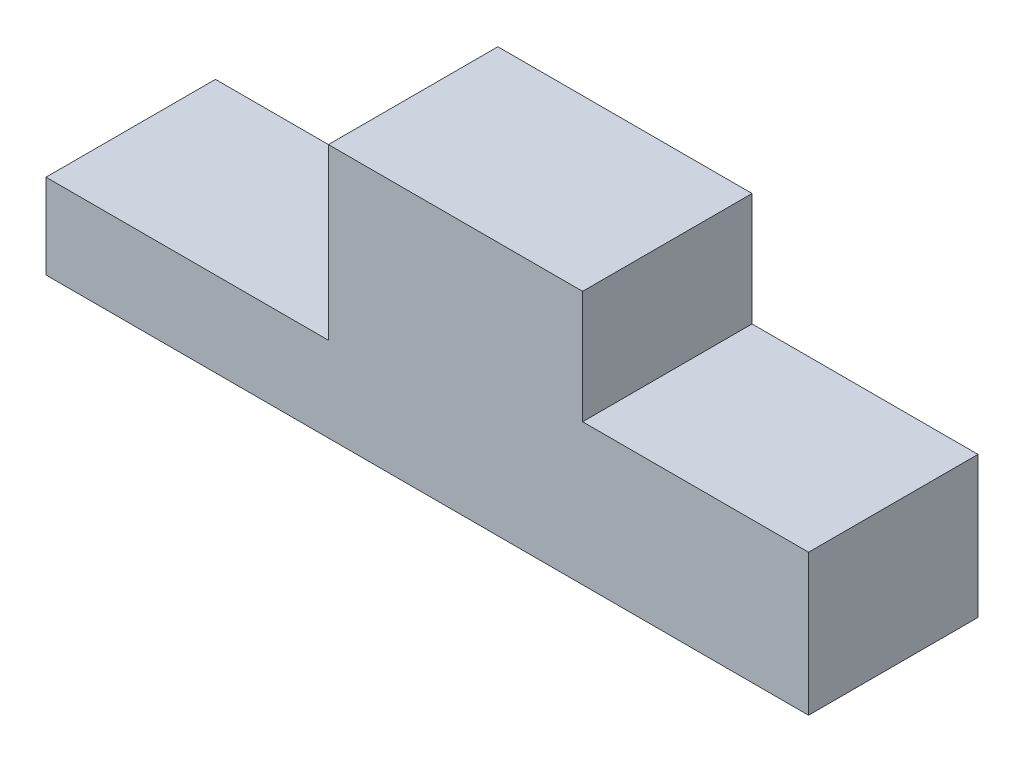
from build123d import *

# Parameters (mm, degrees)
SCHIZZO1_W                   = 50
SCHIZZO1_H                   = 30
ESTRUSIONE_ESTRUSIONE1_DEPTH = 15
SCHIZZO3_W                   = 45
SCHIZZO3_H                   = 15
ESTRUSIONE_ESTRUSIONE2_DEPTH = 15
SCHIZZO4_W                   = 45
SCHIZZO4_H                   = 30
ESTRUSIONE_ESTRUSIONE3_DEPTH = 15
SCHIZZO5_W                   = 40
SCHIZZO5_H                   = 30
ESTRUSIONE_ESTRUSIONE4_DEPTH = 25


with BuildPart() as part:
    # Schizzo1 → Estrusione-Estrusione1 (new body)
    with BuildSketch(Plane(origin=(0, 0, 0), x_dir=(1, 0, 0), z_dir=(0, 1, 0))):
        with Locations((-25, 0)):
            Rectangle(SCHIZZO1_W, SCHIZZO1_H)
    extrude(amount=ESTRUSIONE_ESTRUSIONE1_DEPTH)

    # Schizzo3 → Estrusione-Estrusione2 (add, symmetric)
    with BuildSketch(Plane.XY):
        with Locations((22.5, 7.5)):
            Rectangle(SCHIZZO3_W, SCHIZZO3_H)
    extrude(amount=ESTRUSIONE_ESTRUSIONE2_DEPTH, both=True)

    # Schizzo4 → Estrusione-Estrusione3 (add, symmetric)
    with BuildSketch(Plane.XY):
        with Locations((22.5, 30)):
            Rectangle(SCHIZZO4_W, SCHIZZO4_H)
    extrude(amount=ESTRUSIONE_ESTRUSIONE3_DEPTH, both=True)

    # Schizzo5 → Estrusione-Estrusione4 (add)
    with BuildSketch(Plane(origin=(0, 0, 0), x_dir=(1, 0, 0), z_dir=(0, 1, 0))):
        with Locations((65, 0)):
            Rectangle(SCHIZZO5_W, SCHIZZO5_H)
    extrude(amount=ESTRUSIONE_ESTRUSIONE4_DEPTH)


solid = part.part
